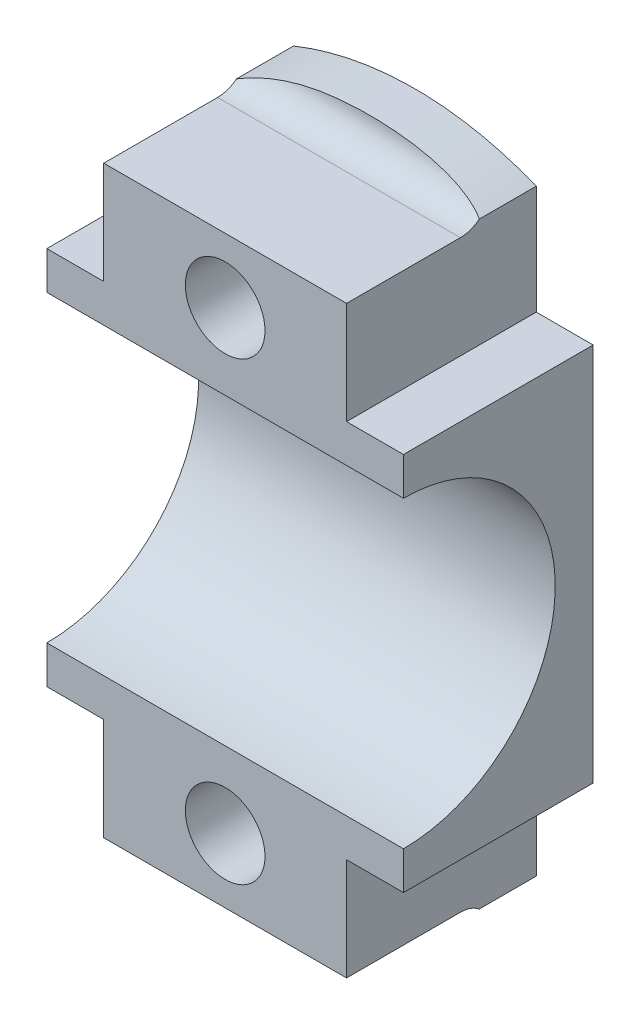
from build123d import *

# Parameters (mm, degrees)
SKETCH1_R           = 10.5
SKETCH1_W           = 94
SKETCH1_H           = 80
BOSS_EXTRUDE1_DEPTH = 50
CUT_EXTRUDE1_DEPTH  = 137.238761004
SKETCH3_R           = 10
BOSS_EXTRUDE2_DEPTH = 5


with BuildPart() as part:
    # Sketch1 → Boss-Extrude1 (new body)
    # profile 1 of 5: a face of its own
    with BuildSketch(Plane.XY):
        with BuildLine():
            Line((32, 67.830671528), (32, 78.74642849))
            ThreePointArc((32, 78.74642849), (0, 85), (-32, 78.74642849))
            Line((-32, 78.74642849), (-32, 67.830671528))
            ThreePointArc((-32, 67.830671528), (0, 75), (32, 67.830671528))
        make_face()
    # profile 2 of 5: a face of its own
    with BuildSketch(Plane.XY):
        with BuildLine():
            Line((32, 67.830671528), (32, 50))
            Line((32, 50), (47, 50))
            Line((47, 50), (47, 40))
            Line((47, 40), (-47, 40))
            Line((-47, 40), (-47, 50))
            Line((-47, 50), (-32, 50))
            Line((-32, 50), (-32, 67.830671528))
            ThreePointArc((-32, 67.830671528), (0, 75), (32, 67.830671528))
        make_face()
        with Locations((0, 60)):
            Circle(SKETCH1_R, mode=Mode.SUBTRACT)
    # profile 3 of 5: a face of its own
    with BuildSketch(Plane.XY):
        Rectangle(SKETCH1_W, SKETCH1_H)
    # profile 4 of 5: a face of its own
    with BuildSketch(Plane.XY):
        with BuildLine():
            Line((-32, -67.830671528), (-32, -50))
            Line((-32, -50), (-47, -50))
            Line((-47, -50), (-47, -40))
            Line((-47, -40), (47, -40))
            Line((47, -40), (47, -50))
            Line((47, -50), (32, -50))
            Line((32, -50), (32, -67.830671528))
            ThreePointArc((32, -67.830671528), (0, -75), (-32, -67.830671528))
        make_face()
        with Locations((0, -60)):
            Circle(SKETCH1_R, mode=Mode.SUBTRACT)
    # profile 5 of 5: a face of its own
    with BuildSketch(Plane.XY):
        with BuildLine():
            Line((-32, -67.830671528), (-32, -78.74642849))
            ThreePointArc((-32, -78.74642849), (0, -85), (32, -78.74642849))
            Line((32, -78.74642849), (32, -67.830671528))
            ThreePointArc((32, -67.830671528), (0, -75), (-32, -67.830671528))
        make_face()
    extrude(amount=BOSS_EXTRUDE1_DEPTH)

    # Sketch2 → Cut-Extrude1 (cut, through all)
    with BuildSketch(Plane(origin=(47, 0, 0), x_dir=(0, 0, -1), z_dir=(1, 0, 0))):
        with BuildLine():
            Line((-50, 40), (-50, -40))
            ThreePointArc((-50, -40), (-10, 0), (-50, 40))
        make_face()
        with BuildLine():
            Line((-50, -77), (-20, -77))
            ThreePointArc((-20, -77), (-14.343145751, -79.343145751), (-12, -85))
            Line((-12, -85), (-50, -85))
            Line((-50, -85), (-50, -77))
        make_face()
        with BuildLine():
            Line((-50, 85), (-12, 85))
            ThreePointArc((-12, 85), (-14.343145751, 79.343145751), (-20, 77))
            Line((-20, 77), (-50, 77))
            Line((-50, 77), (-50, 85))
        make_face()
    extrude(amount=-CUT_EXTRUDE1_DEPTH, mode=Mode.SUBTRACT)

    # Sketch3 → Boss-Extrude2 (add)
    with BuildSketch(Plane(origin=(0, 0, 0), x_dir=(-1, 0, 0), z_dir=(0, 0, -1))):
        with Locations(Location((0, 0, 0), (0, 0, 180))):
            Circle(SKETCH3_R)
    extrude(amount=BOSS_EXTRUDE2_DEPTH)


solid = part.part
